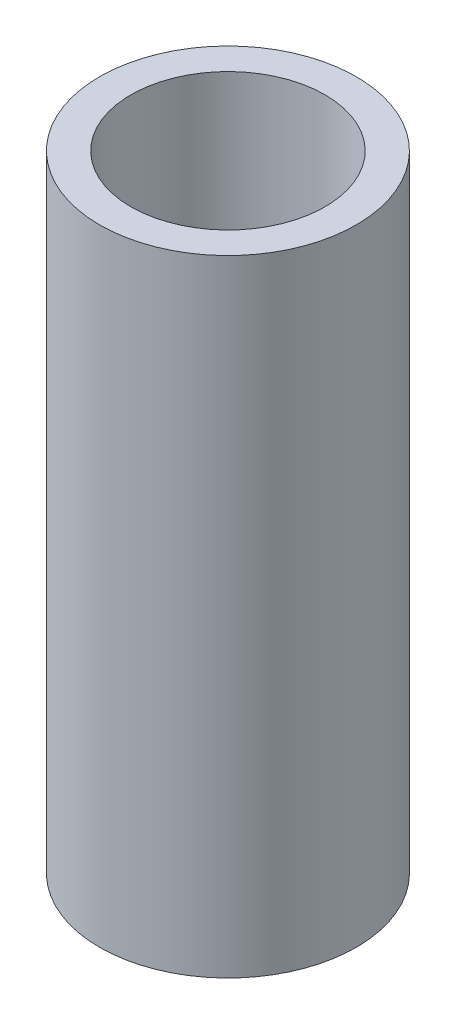
from build123d import *

# Parameters (mm, degrees)
SKETCH1_R           = 4
SKETCH1_R_2         = 3.025
BOSS_EXTRUDE1_DEPTH = 19.5


with BuildPart() as part:
    # Sketch1 → Boss-Extrude1 (new body)
    with BuildSketch(Plane(origin=(0, 0, 0), x_dir=(1, 0, 0), z_dir=(0, 1, 0))):
        with Locations(Location((0, 0, 0), (0, 0, 270))):
            Circle(SKETCH1_R)
        with Locations(Location((0, 0, 0), (0, 0, 270))):
            Circle(SKETCH1_R_2, mode=Mode.SUBTRACT)
    extrude(amount=BOSS_EXTRUDE1_DEPTH)


solid = part.part
